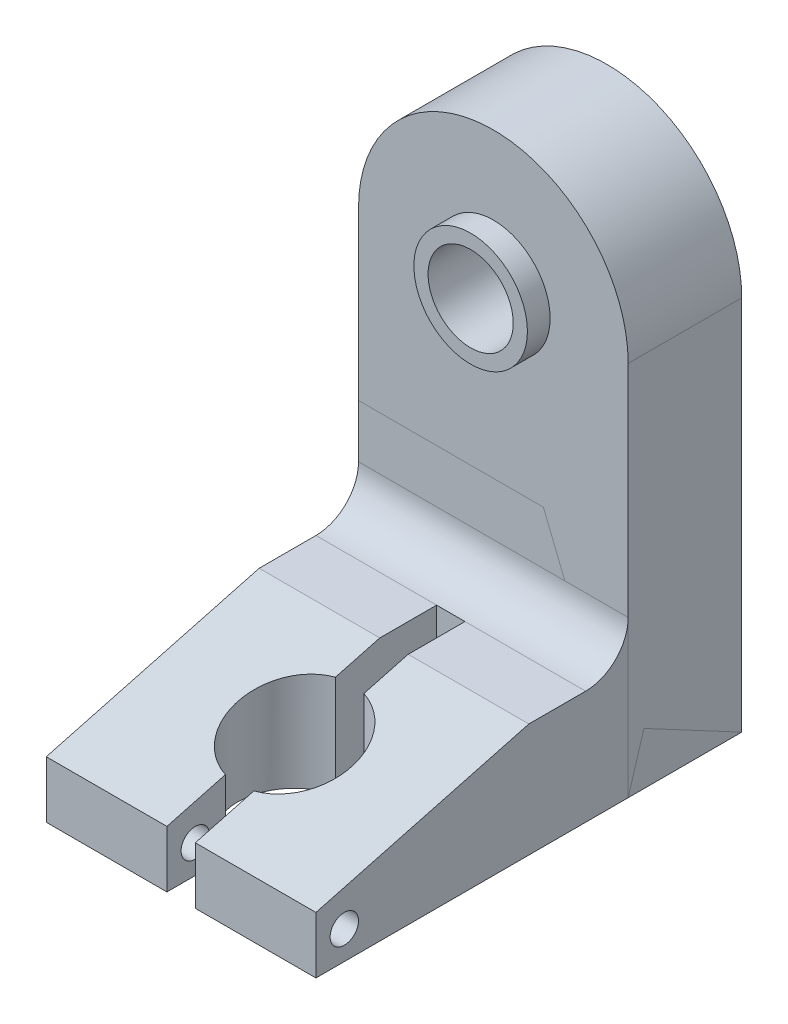
from build123d import *

# Parameters (mm, degrees)
CROQUIS1_R              = 15
SALIENTE_EXTRUIR1_DEPTH = 40
SALIENTE_EXTRUIR2_DEPTH = 95
REDONDEO1_R             = 15
CORTAR_EXTRUIR1_DEPTH   = 95
CROQUIS4_R              = 5
CORTAR_EXTRUIR2_DEPTH   = 95
CROQUIS5_R              = 20
CROQUIS5_R_2            = 15
SALIENTE_EXTRUIR3_DEPTH = 8


with BuildPart() as part:
    # Croquis1 → Saliente-Extruir1 (new body)
    with BuildSketch(Plane.XY):
        with BuildLine():
            Line((-47.5, 66.25), (-47.5, -66.25))
            Line((-47.5, -66.25), (47.5, -66.25))
            Line((47.5, -66.25), (47.5, 66.25))
            ThreePointArc((47.5, 66.25), (0, 113.75), (-47.5, 66.25))
        make_face()
        with Locations((0, 66.25)):
            Circle(CROQUIS1_R, mode=Mode.SUBTRACT)
    extrude(amount=SALIENTE_EXTRUIR1_DEPTH)

    # Croquis5 → Saliente-Extruir3 (add)
    with BuildSketch(Plane.XY.offset(40)):
        with Locations((0, 66.25)):
            Circle(CROQUIS5_R)
        with Locations((0, 66.25)):
            Circle(CROQUIS5_R_2, mode=Mode.SUBTRACT)
    extrude(amount=SALIENTE_EXTRUIR3_DEPTH)


with BuildPart() as body_2:
    # Croquis2 → Saliente-Extruir2 (new body)
    with BuildSketch(Plane.ZY.offset(47.5)):
        Polygon((40, -26.25), (75, -26.25), (150, -46.25), (150, -66.25), (40, -66.25), (0, -66.25), (0, 7.445462918), (40, 7.445462918), align=None)
    extrude(amount=-SALIENTE_EXTRUIR2_DEPTH)

    # Redondeo1
    redondeo1_edges = [body_2.edges().sort_by_distance(p)[0] for p in [
        (0, -26.25, 40),
    ]]
    fillet(redondeo1_edges, radius=REDONDEO1_R)

    # Croquis3 → Cortar-Extruir1 (cut)
    with BuildSketch(Plane(origin=(0, -26.25, 0), x_dir=(1, 0, 0), z_dir=(0, 1, 0))):
        with BuildLine():
            Line((0, -55), (5, -55))
            Line((5, -55), (5, -90.635083269))
            ThreePointArc((5, -90.635083269), (20, -110), (5, -129.364916731))
            Line((5, -129.364916731), (5, -150))
            Line((5, -150), (-5, -150))
            Line((-5, -150), (-5, -129.364916731))
            ThreePointArc((-5, -129.364916731), (-20, -110), (-5, -90.635083269))
            Line((-5, -90.635083269), (-5, -55))
            Line((-5, -55), (0, -55))
        make_face()
    extrude(amount=-CORTAR_EXTRUIR1_DEPTH, mode=Mode.SUBTRACT)

    # Croquis4 → Cortar-Extruir2 (cut)
    with BuildSketch(Plane(origin=(47.5, 0, 0), x_dir=(0, 0, -1), z_dir=(1, 0, 0))):
        with Locations((-140, -56.25)):
            Circle(CROQUIS4_R)
    extrude(amount=-CORTAR_EXTRUIR2_DEPTH, mode=Mode.SUBTRACT)


solid = Compound([part.part, body_2.part])
